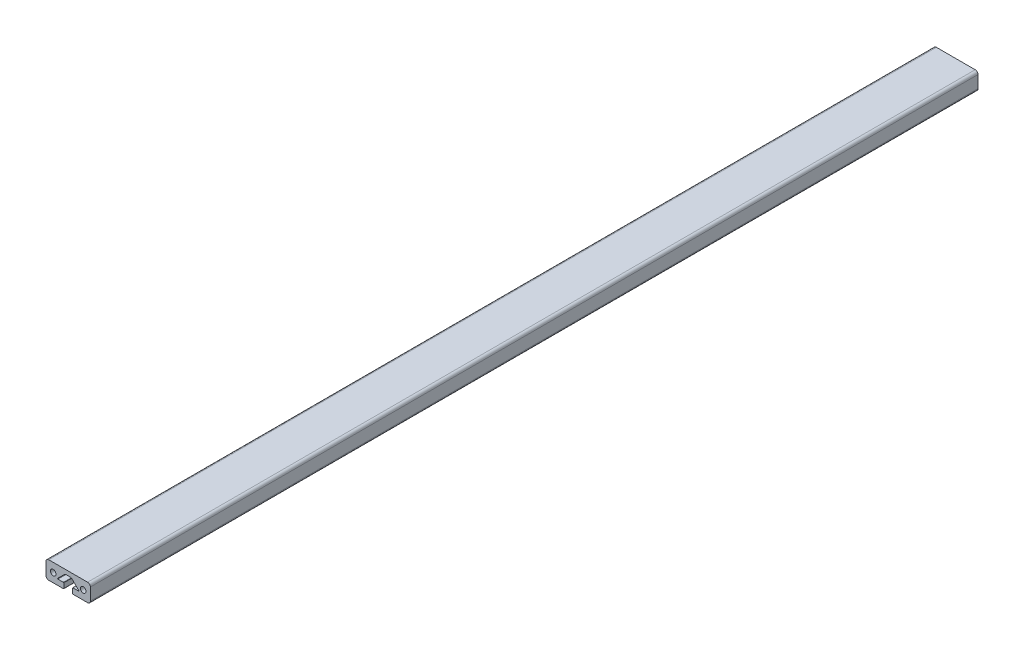
from build123d import *

# Parameters (mm, degrees)
SKETCH_1_R      = 2.5
EXTRUDE_1_DEPTH = 800


with BuildPart() as part:
    # 草图1 → 凸台-拉伸1 (new body)
    with BuildSketch(Plane.XY):
        with BuildLine():
            Line((-1.091758205, 3.745792426), (2.851387546, 3.745792426))
            ThreePointArc((2.851387546, 3.745792426), (3.61675441, 3.593551491), (4.265601108, 3.160005989))
            Line((4.265601108, 3.160005989), (10.367682636, -2.942075539))
            ThreePointArc((10.367682636, -2.942075539), (10.432714461, -3.269012603), (10.155550602, -3.454207574))
            Line((10.155550602, -3.454207574), (5.17981467, -3.454207574))
            ThreePointArc((5.17981467, -3.454207574), (4.967682636, -3.542075539), (4.87981467, -3.754207574))
            Line((4.87981467, -3.754207574), (4.87981467, -8.154207574))
            ThreePointArc((4.87981467, -8.154207574), (4.967682636, -8.366339608), (5.17981467, -8.454207574))
            Line((5.17981467, -8.454207574), (18.37981467, -8.454207574))
            ThreePointArc((18.37981467, -8.454207574), (20.147581623, -7.721974527), (20.87981467, -5.954207574))
            Line((20.87981467, -5.954207574), (20.87981467, 5.045792426))
            ThreePointArc((20.87981467, 5.045792426), (20.147581623, 6.813559379), (18.37981467, 7.545792426))
            Line((18.37981467, 7.545792426), (-16.62018533, 7.545792426))
            ThreePointArc((-16.62018533, 7.545792426), (-18.387952283, 6.813559379), (-19.12018533, 5.045792426))
            Line((-19.12018533, 5.045792426), (-19.12018533, -5.954207574))
            ThreePointArc((-19.12018533, -5.954207574), (-18.387952283, -7.721974527), (-16.62018533, -8.454207574))
            Line((-16.62018533, -8.454207574), (-3.42018533, -8.454207574))
            ThreePointArc((-3.42018533, -8.454207574), (-3.208053295, -8.366339608), (-3.12018533, -8.154207574))
            Line((-3.12018533, -8.154207574), (-3.12018533, -3.754207574))
            ThreePointArc((-3.12018533, -3.754207574), (-3.208053295, -3.542075539), (-3.42018533, -3.454207574))
            Line((-3.42018533, -3.454207574), (-8.395921261, -3.454207574))
            ThreePointArc((-8.395921261, -3.454207574), (-8.673085121, -3.269012603), (-8.608053295, -2.942075539))
            Line((-8.608053295, -2.942075539), (-2.505971767, 3.160005989))
            ThreePointArc((-2.505971767, 3.160005989), (-1.85712507, 3.593551491), (-1.091758205, 3.745792426))
        make_face()
        with Locations((-12.62018533, -0.454207574)):
            Circle(SKETCH_1_R, mode=Mode.SUBTRACT)
        with Locations((14.37981467, -0.454207574)):
            Circle(SKETCH_1_R, mode=Mode.SUBTRACT)
    extrude(amount=EXTRUDE_1_DEPTH)


solid = part.part
